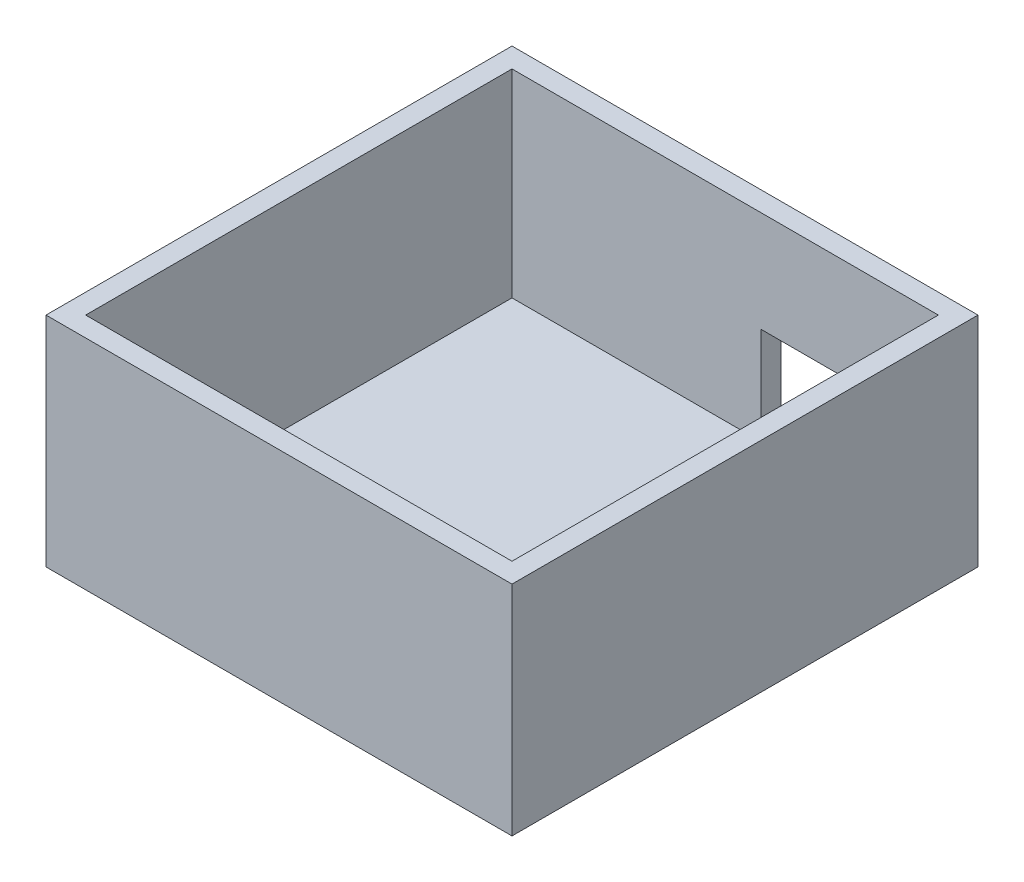
from build123d import *

# Parameters (mm, degrees)
IZIM2_W                     = 215
IZIM2_H                     = 215
Y_KSEKLIK_EKSTR_ZYON1_DEPTH = 100
IZIM3_W                     = 235
IZIM3_H                     = 235
Y_KSEKLIK_EKSTR_ZYON2_DEPTH = 10
KES_EKSTR_ZYON1_REACH       = 283.125
IZIM5_W                     = 74.73555952
IZIM5_H                     = 40.37033127


with BuildPart() as part:
    # Çizim2 → Yükseklik-Ekstrüzyon1 (new body)
    with BuildSketch(Plane(origin=(0, 0, 0), x_dir=(1, 0, 0), z_dir=(0, 1, 0))):
        Polygon((117.5, 112.5), (117.5, 102.5), (117.5, -112.5), (117.5, -122.5), (107.5, -122.5), (-107.5, -122.5), (-117.5, -122.5), (-117.5, -112.5), (-117.5, 112.5), (-107.5, 112.5), (107.5, 112.5), align=None)
        with Locations((0, -5)):
            Rectangle(IZIM2_W, IZIM2_H, mode=Mode.SUBTRACT)
    extrude(amount=Y_KSEKLIK_EKSTR_ZYON1_DEPTH)

    # Çizim3 → Yükseklik-Ekstrüzyon2 (add)
    with BuildSketch(Plane.XZ):
        with Locations((0, 5)):
            Rectangle(IZIM3_W, IZIM3_H)
    extrude(amount=Y_KSEKLIK_EKSTR_ZYON2_DEPTH)

    # Çizim5 → Kes-Ekstrüzyon1 (cut, up to next)
    with BuildSketch(Plane(origin=(0, 0, -112.5), x_dir=(-1, 0, 0), z_dir=(0, 0, -1)), mode=Mode.PRIVATE) as kes_ekstr_zyon1_sk1:
        with Locations((-55.507242177, 28.884807523)):
            Rectangle(IZIM5_W, IZIM5_H)
    kes_ekstr_zyon1_tool1 = extrude(kes_ekstr_zyon1_sk1.sketch, amount=-KES_EKSTR_ZYON1_REACH, mode=Mode.PRIVATE) & part.part
    add(kes_ekstr_zyon1_tool1.solids().sort_by_distance((55.507242, 28.884808, -112.5))[0], mode=Mode.SUBTRACT)


solid = part.part
